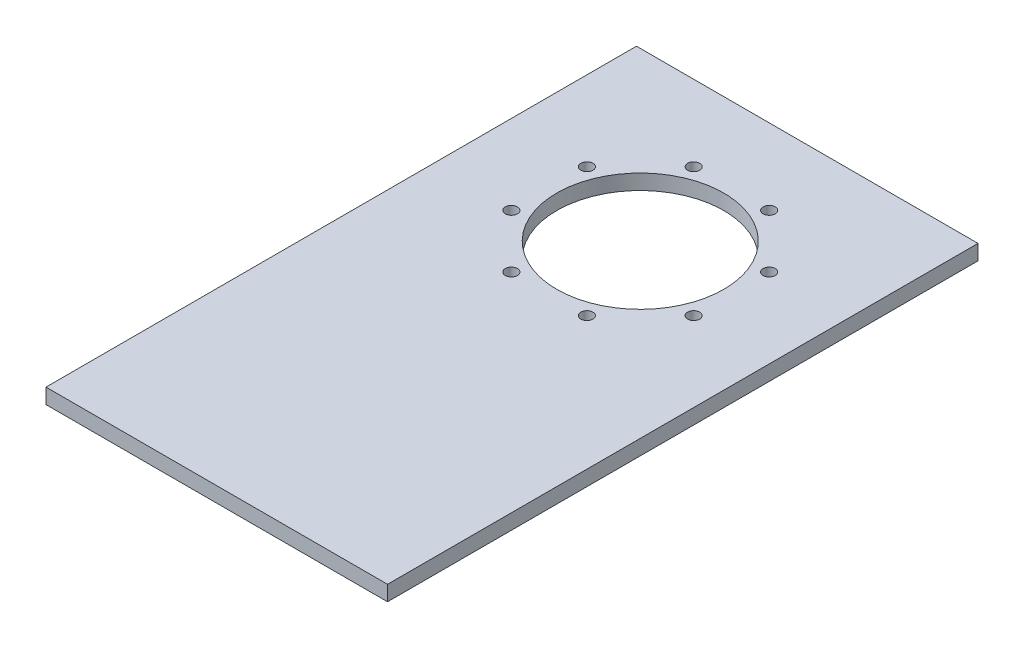
from build123d import *

# Parameters (mm, degrees)
SKETCH1_W           = 225
SKETCH1_H           = 220
SKETCH1_R           = 55
BOSS_EXTRUDE1_DEPTH = 10
SKETCH2_R           = 4
CUT_EXTRUDE1_DEPTH  = 10
SKETCH3_W           = 225
SKETCH3_H           = 10
BOSS_EXTRUDE2_DEPTH = 169


with BuildPart() as part:
    # Sketch1 → Boss-Extrude1 (new body)
    with BuildSketch(Plane(origin=(0, 0, 0), x_dir=(1, 0, 0), z_dir=(0, 1, 0))):
        Rectangle(SKETCH1_W, SKETCH1_H)
        with Locations(Location((0, 0, 0), (0, 0, 270))):
            Circle(SKETCH1_R, mode=Mode.SUBTRACT)
    extrude(amount=BOSS_EXTRUDE1_DEPTH)

    # Sketch2 → Cut-Extrude1 (cut)
    with BuildSketch(Plane(origin=(0, 0, 0), x_dir=(1, 0, 0), z_dir=(0, 1, 0))):
        with Locations(Location((-24.874423104, -60.052169613, 0), (0, 0, 270))):
            Circle(SKETCH2_R)
        with Locations(Location((-60.052169613, -24.874423104, 0), (0, 0, 270))):
            Circle(SKETCH2_R)
        with Locations(Location((-60.052169613, 24.874423104, 0), (0, 0, 270))):
            Circle(SKETCH2_R)
        with Locations(Location((-24.874423104, 60.052169613, 0), (0, 0, 270))):
            Circle(SKETCH2_R)
        with Locations(Location((24.874423104, 60.052169613, 0), (0, 0, 270))):
            Circle(SKETCH2_R)
        with Locations(Location((60.052169613, 24.874423104, 0), (0, 0, 270))):
            Circle(SKETCH2_R)
        with Locations(Location((60.052169613, -24.874423104, 0), (0, 0, 270))):
            Circle(SKETCH2_R)
        with Locations(Location((24.874423104, -60.052169613, 0), (0, 0, 270))):
            Circle(SKETCH2_R)
    extrude(amount=CUT_EXTRUDE1_DEPTH, mode=Mode.SUBTRACT)

    # Sketch3 → Boss-Extrude2 (add)
    with BuildSketch(Plane.XY.offset(110)):
        with Locations((0, 5)):
            Rectangle(SKETCH3_W, SKETCH3_H)
    extrude(amount=BOSS_EXTRUDE2_DEPTH)


solid = part.part
